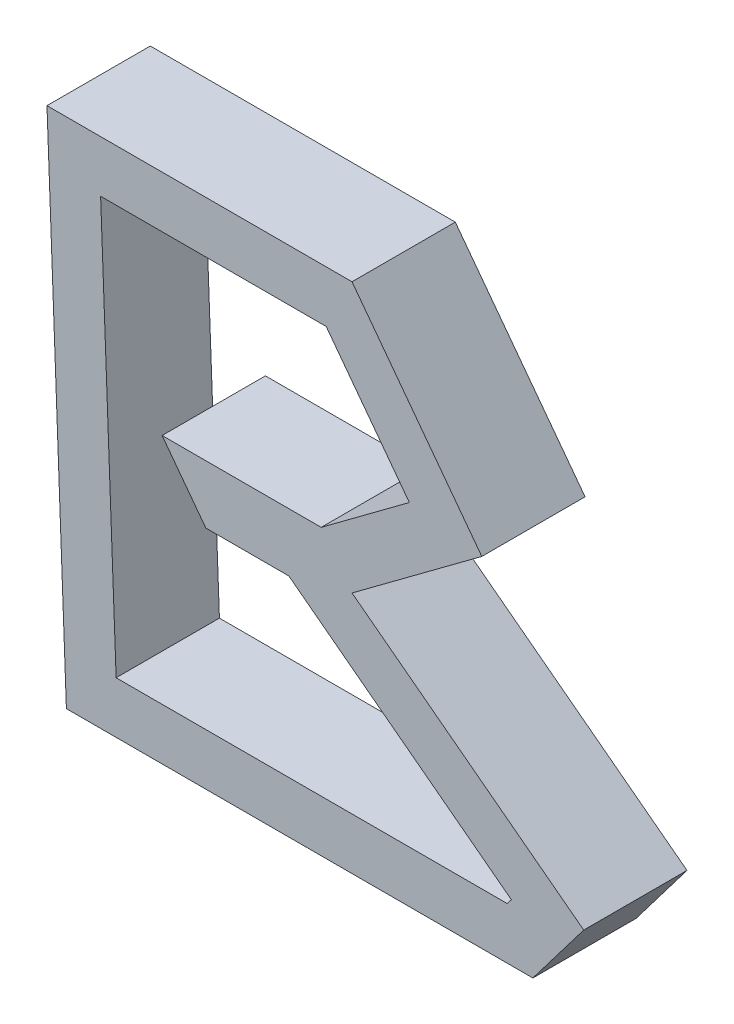
from build123d import *

# Parameters (mm, degrees)
BOSS_EXTRUDE4_DEPTH = 20
CUT_EXTRUDE1_DEPTH  = 89.134124702


with BuildPart() as part:
    # Sketch1 → Boss-Extrude4 (new body)
    with BuildSketch(Plane.XY):
        Polygon((-32.575757576, -52.904040404), (-36.334940312, 46.338383838), (22.727272727, 46.338383838), (47.853859566, 12.836268054), (22.727272727, -5.850467639), (67.592798773, -39.94137673), (57.74316526, -52.904040404), align=None)
    extrude(amount=BOSS_EXTRUDE4_DEPTH)

    # Sketch3 → Cut-Extrude1 (cut, through all)
    with BuildSketch(Plane.XY.offset(20)):
        Polygon((10.494111386, -9.114469372), (-5.575689301, -9.114469372), (-14.041829745, 2.173717887), (16.759656232, 2.173717887), (33.829559486, 14.868668159), (17.727272727, 36.338383838), (-25.948980992, 36.338383838), (-22.947374013, -42.904040404), (52.782303891, -42.904040404), (53.580530259, -41.853530257), align=None)
    extrude(amount=-CUT_EXTRUDE1_DEPTH, mode=Mode.SUBTRACT)


solid = part.part
